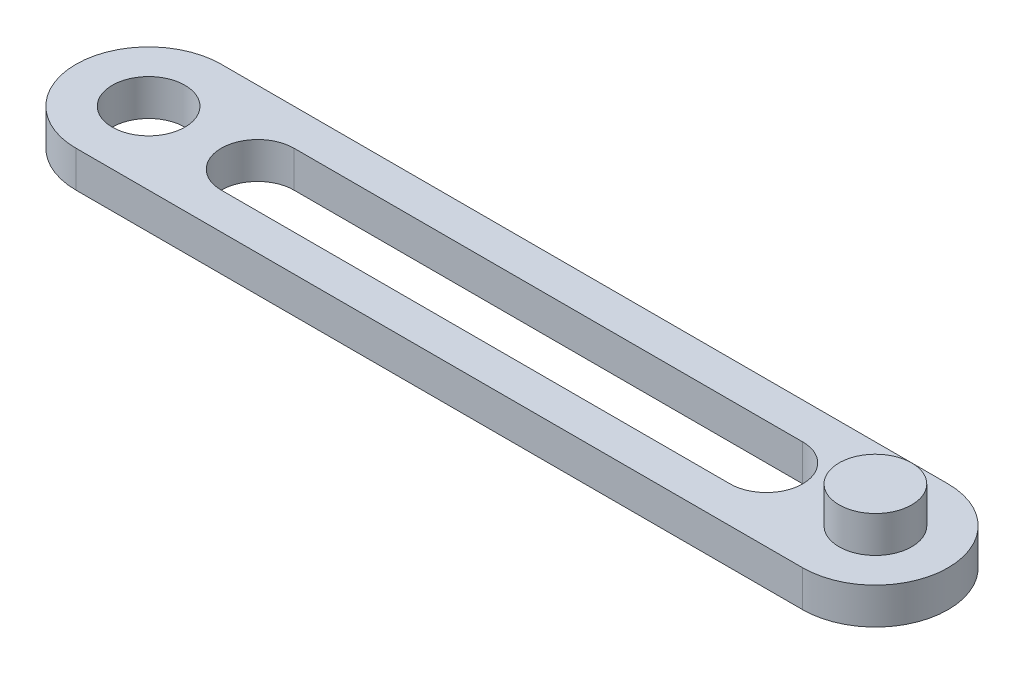
from build123d import *

# Parameters (mm, degrees)
BOSS_EXTRUDE1_DEPTH = 5
CUT_EXTRUDE1_DEPTH  = 62.032778079
SKETCH3_R           = 5
BOSS_EXTRUDE2_DEPTH = 5
SKETCH4_R           = 5
CUT_EXTRUDE2_DEPTH  = 62.032778079


with BuildPart() as part:
    # Sketch1 → Boss-Extrude1 (new body)
    with BuildSketch(Plane(origin=(0, 0, 0), x_dir=(1, 0, 0), z_dir=(0, 1, 0))):
        with BuildLine():
            Line((-50, 10), (50, 10))
            ThreePointArc((50, 10), (60, 0), (50, -10))
            Line((50, -10), (-50, -10))
            ThreePointArc((-50, -10), (-60, 0), (-50, 10))
        make_face()
    extrude(amount=BOSS_EXTRUDE1_DEPTH)

    # Sketch2 → Cut-Extrude1 (cut, through all)
    with BuildSketch(Plane(origin=(0, 5, 0), x_dir=(1, 0, 0), z_dir=(0, 1, 0))):
        with BuildLine():
            Line((-35, 5), (35, 5))
            ThreePointArc((35, 5), (40, 0), (35, -5))
            Line((35, -5), (-35, -5))
            ThreePointArc((-35, -5), (-40, 0), (-35, 5))
        make_face()
    extrude(amount=-CUT_EXTRUDE1_DEPTH, mode=Mode.SUBTRACT)

    # Sketch3 → Boss-Extrude2 (add)
    with BuildSketch(Plane(origin=(0, 5, 0), x_dir=(1, 0, 0), z_dir=(0, 1, 0))):
        with Locations(Location((50, 0, 0), (0, 0, 270))):
            Circle(SKETCH3_R)
    extrude(amount=BOSS_EXTRUDE2_DEPTH)

    # Sketch4 → Cut-Extrude2 (cut, through all)
    with BuildSketch(Plane(origin=(0, 5, 0), x_dir=(1, 0, 0), z_dir=(0, 1, 0))):
        with Locations(Location((-50, 0, 0), (0, 0, 270))):
            Circle(SKETCH4_R)
    extrude(amount=-CUT_EXTRUDE2_DEPTH, mode=Mode.SUBTRACT)


solid = part.part
